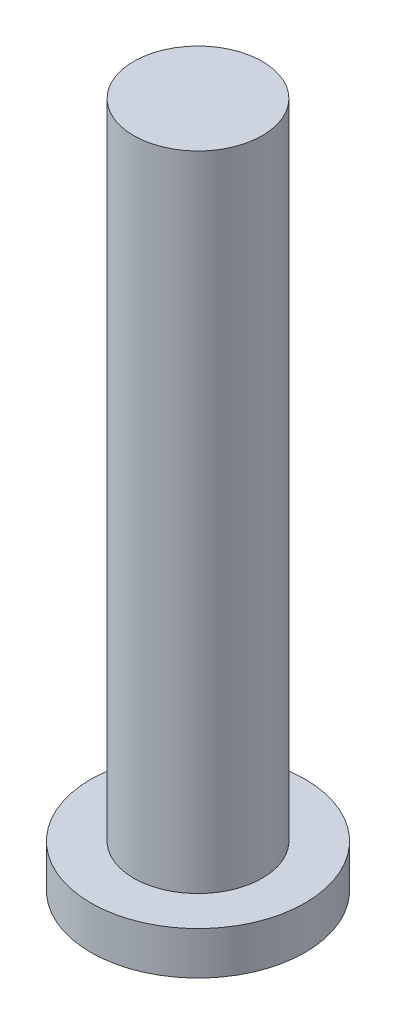
from build123d import *

# Parameters (mm, degrees)
SKETCH1_R           = 2.5
BOSS_EXTRUDE1_DEPTH = 1
SKETCH3_R           = 1.5
BOSS_EXTRUDE2_DEPTH = 15


with BuildPart() as part:
    # Sketch1 → Boss-Extrude1 (new body)
    with BuildSketch(Plane(origin=(0, 0, 0), x_dir=(1, 0, 0), z_dir=(0, 1, 0))):
        with Locations(Location((0, 0, 0), (0, 0, 270))):
            Circle(SKETCH1_R)
    extrude(amount=BOSS_EXTRUDE1_DEPTH)

    # Sketch3 → Boss-Extrude2 (add)
    with BuildSketch(Plane(origin=(0, 1, 0), x_dir=(-1, 0, 0), z_dir=(0, 1, 0))):
        with Locations(Location((0, 0, 0), (0, 0, 90))):
            Circle(SKETCH3_R)
    extrude(amount=BOSS_EXTRUDE2_DEPTH)


solid = part.part
